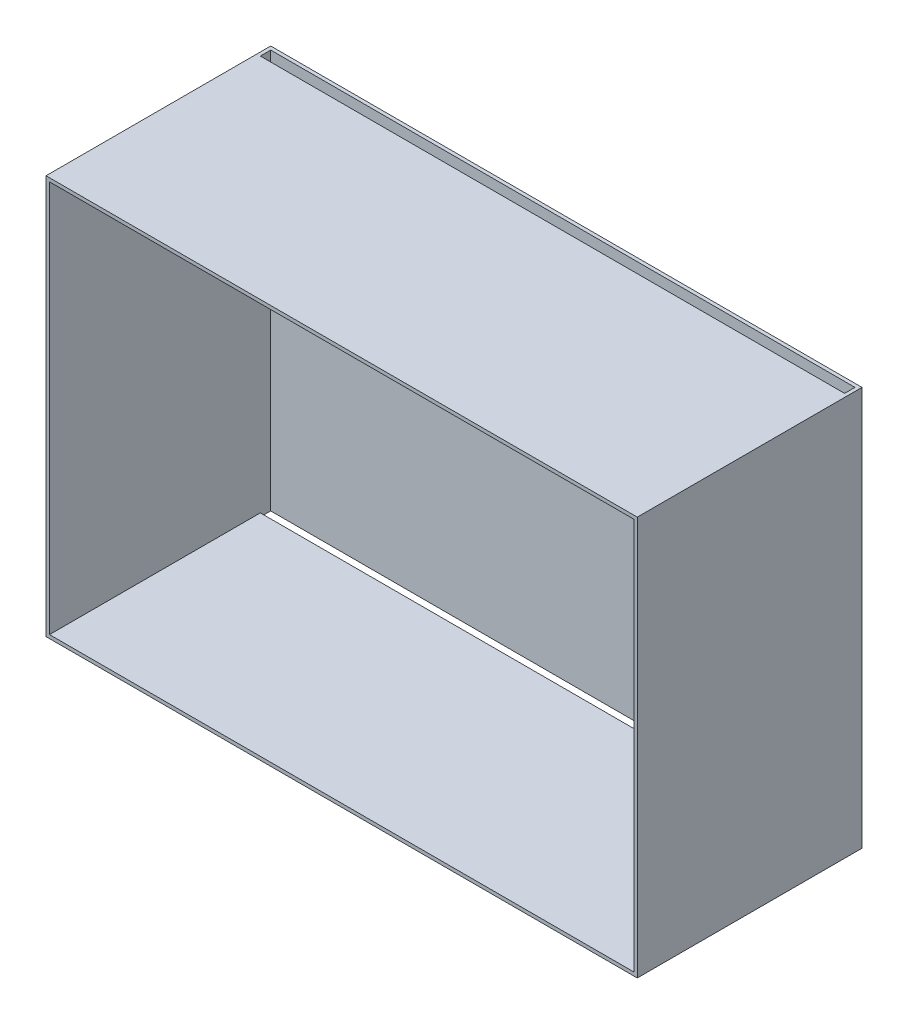
from build123d import *

# Parameters (mm, degrees)
SKETCH1_W           = 534.67
SKETCH1_H           = 360.934
SKETCH1_W_2         = 528.32
SKETCH1_H_2         = 354.584
BOSS_EXTRUDE1_DEPTH = 203.2
SHELL1_T            = -3.175
SKETCH2_W           = 528.32
SKETCH2_H           = 9.398
CUT_EXTRUDE1_DEPTH  = 493.982347129


with BuildPart() as part:
    # Sketch1 → Boss-Extrude1 (new body)
    # profile 1 of 2: a face of its own
    with BuildSketch(Plane.XY):
        Rectangle(SKETCH1_W, SKETCH1_H)
        Rectangle(SKETCH1_W_2, SKETCH1_H_2, mode=Mode.SUBTRACT)
    # profile 2 of 2: a face of its own
    with BuildSketch(Plane.XY):
        Rectangle(SKETCH1_W_2, SKETCH1_H_2)
    extrude(amount=BOSS_EXTRUDE1_DEPTH)

    # Shell1
    shell1_openings = [part.faces().sort_by_distance(p)[0] for p in [
        (0, 0, 203.2),
    ]]
    offset(amount=SHELL1_T, openings=shell1_openings, kind=Kind.INTERSECTION)

    # Sketch2 → Cut-Extrude1 (cut, through all)
    with BuildSketch(Plane.XZ.offset(180.467)):
        with Locations((0, 7.874)):
            Rectangle(SKETCH2_W, SKETCH2_H)
    extrude(amount=-CUT_EXTRUDE1_DEPTH, mode=Mode.SUBTRACT)


solid = part.part
